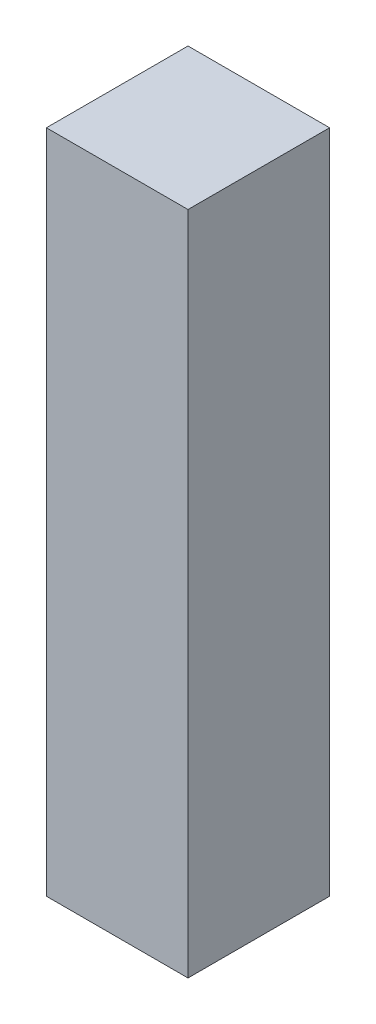
from build123d import *

# Parameters (mm, degrees)
SKETCH1_W           = 200
SKETCH1_H           = 200
BOSS_EXTRUDE1_DEPTH = 940


with BuildPart() as part:
    # Sketch1 → Boss-Extrude1 (new body)
    with BuildSketch(Plane(origin=(0, 0, 0), x_dir=(1, 0, 0), z_dir=(0, 1, 0))):
        Rectangle(SKETCH1_W, SKETCH1_H)
    extrude(amount=-BOSS_EXTRUDE1_DEPTH)


solid = part.part
